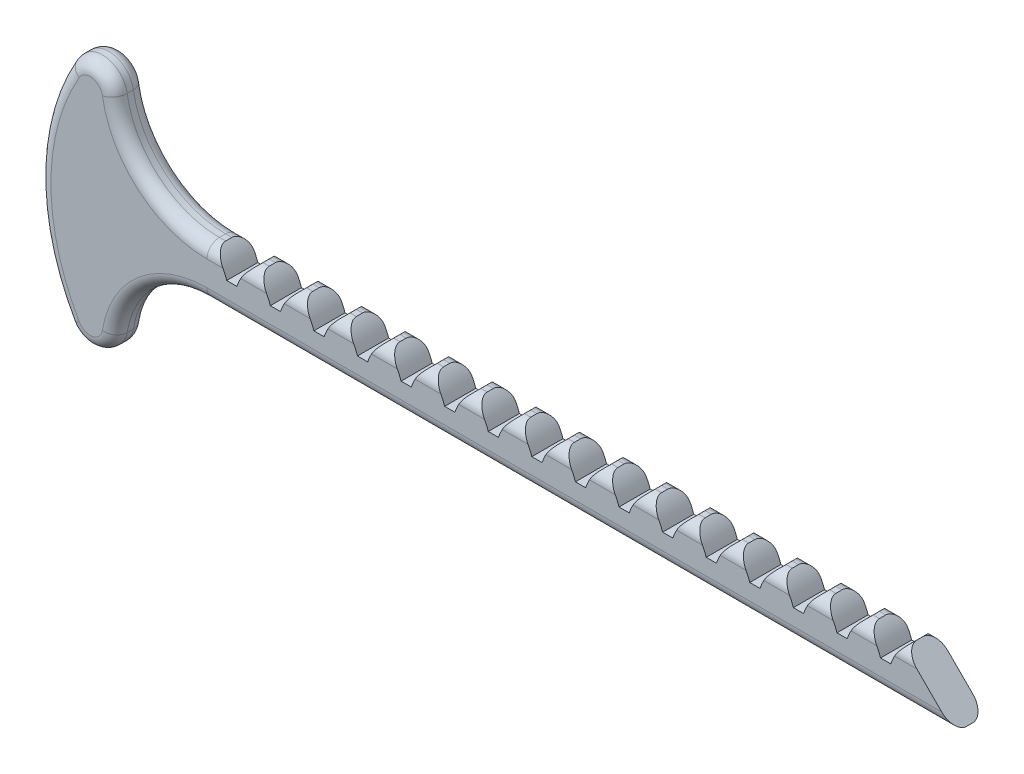
from build123d import *

# Parameters (mm, degrees)
BOSS_EXTRUDE1_DEPTH = 1.5875
FILLET1_R           = 1.27
CUT_EXTRUDE1_DEPTH  = 58.360405638
LPATTERN1_COUNT     = 16
LPATTERN1_PITCH     = 4.445


with BuildPart() as part:
    # Sketch1 → Boss-Extrude1 (new, symmetric)
    with BuildSketch(Plane.XY):
        with BuildLine():
            Line((-38.1, 0), (38.1, 0))
            Line((38.1, 0), (33.02, 5.08))
            Line((33.02, 5.08), (-38.1, 5.08))
            ThreePointArc((-38.1, 5.08), (-44.280636145, 7.357561705), (-47.505517918, 13.101052632))
            ThreePointArc((-47.505517918, 13.101052632), (-49.552624359, 15.197809), (-52.213360556, 13.97))
            ThreePointArc((-52.213360556, 13.97), (-55.276019825, 2.54), (-52.213360556, -8.89))
            ThreePointArc((-52.213360556, -8.89), (-49.552624359, -10.117809), (-47.505517918, -8.021052632))
            ThreePointArc((-47.505517918, -8.021052632), (-44.280636145, -2.277561705), (-38.1, 0))
        make_face()
    extrude(amount=BOSS_EXTRUDE1_DEPTH, both=True)

    # Fillet1
    fillet1_edges = [part.edges().sort_by_distance(p)[0] for p in [
        (-2.54, 5.08, -1.5875),
        (0, 0, -1.5875),
        (-44.280636145, -2.277561705, -1.5875),
        (-2.54, 5.08, 1.5875),
        (-44.280636145, 7.357561705, 1.5875),
        (-49.552624359, 15.197809, 1.5875),
        (-55.276019825, 2.54, 1.5875),
        (-49.552624359, -10.117809, 1.5875),
        (-44.280636145, -2.277561705, 1.5875),
        (-49.552624359, -10.117809, -1.5875),
        (0, 0, 1.5875),
        (-55.276019825, 2.54, -1.5875),
        (-49.552624359, 15.197809, -1.5875),
        (-44.280636145, 7.357561705, -1.5875),
    ]]
    fillet(fillet1_edges, radius=FILLET1_R)

    # Sketch3 → Cut-Extrude1 (cut, symmetric)
    with BuildSketch(Plane.XY):
        with BuildLine():
            Line((30.592919151, 2.921), (31.637080849, 2.921))
            ThreePointArc((31.637080849, 2.921), (32.190091062, 4.089181925), (33.02, 5.08))
            Line((33.02, 5.08), (29.21, 5.08))
            ThreePointArc((29.21, 5.08), (30.039908938, 4.089181925), (30.592919151, 2.921))
        make_face()
    cut_extrude1 = extrude(amount=CUT_EXTRUDE1_DEPTH, both=True, mode=Mode.SUBTRACT)

    # LPattern1: Cut-Extrude1 ×16
    with Locations(*[(-i * LPATTERN1_PITCH, 0, 0) for i in range(1, LPATTERN1_COUNT)]):
        add(cut_extrude1, mode=Mode.SUBTRACT)


solid = part.part
